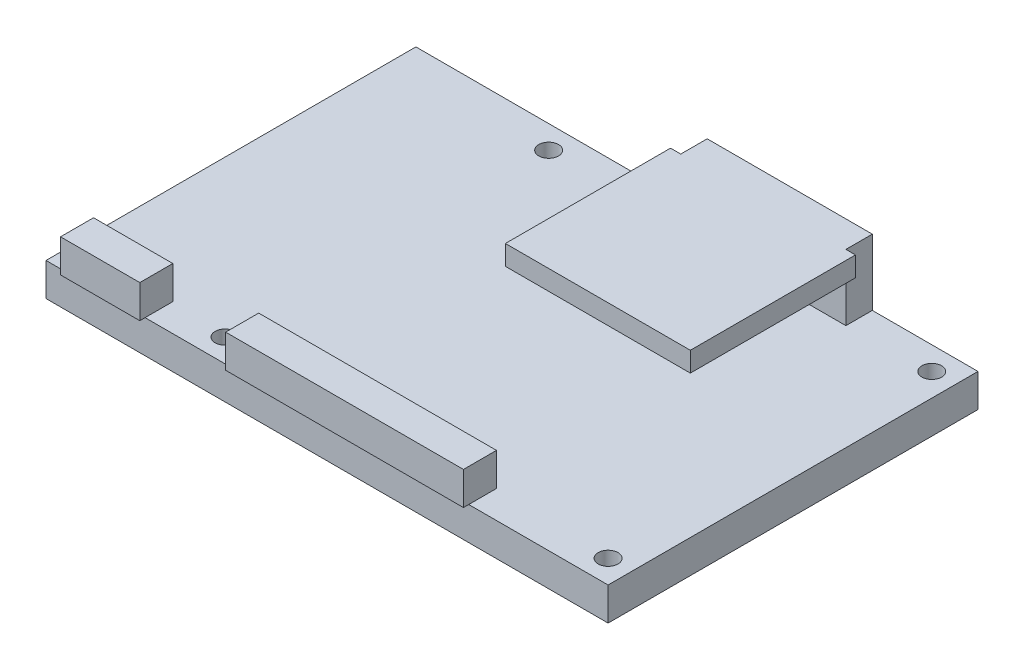
from build123d import *

# Parameters (mm, degrees)
SKETCH1_W           = 85.1
SKETCH1_H           = 56
SKETCH1_R           = 1.5
BOSS_EXTRUDE1_DEPTH = 5
SKETCH3_W           = 12
SKETCH3_H           = 5
BOSS_EXTRUDE2_DEPTH = 5
SKETCH4_W           = 25
SKETCH4_H           = 4
BOSS_EXTRUDE3_DEPTH = 10
SKETCH5_W           = 28
SKETCH5_H           = 3
BOSS_EXTRUDE4_DEPTH = 25


with BuildPart() as part:
    # Sketch1 → Boss-Extrude1 (new body)
    with BuildSketch(Plane(origin=(0, 0, 0), x_dir=(1, 0, 0), z_dir=(0, 1, 0))):
        Rectangle(SKETCH1_W, SKETCH1_H)
        with Locations(Location((-18.95, -24.5, 0), (0, 0, 270))):
            Circle(SKETCH1_R, mode=Mode.SUBTRACT)
        with Locations(Location((39.05, -24.5, 0), (0, 0, 270))):
            Circle(SKETCH1_R, mode=Mode.SUBTRACT)
        with Locations(Location((39.05, 24.5, 0), (0, 0, 270))):
            Circle(SKETCH1_R, mode=Mode.SUBTRACT)
        with Locations(Location((-18.95, 24.5, 0), (0, 0, 270))):
            Circle(SKETCH1_R, mode=Mode.SUBTRACT)
    extrude(amount=BOSS_EXTRUDE1_DEPTH)

    # Sketch3 → Boss-Extrude2 (add)
    with BuildSketch(Plane(origin=(0, 5, 0), x_dir=(1, 0, 0), z_dir=(0, 1, 0))):
        with Locations((-33.55, -26.3)):
            Rectangle(SKETCH3_W, SKETCH3_H)
        with Locations((-8.55, -26.3)):
            Rectangle(SKETCH3_W, SKETCH3_H)
        with Locations((3.45, -26.3)):
            Rectangle(SKETCH3_W, SKETCH3_H)
        with Locations((15.45, -26.3)):
            Rectangle(SKETCH3_W, SKETCH3_H)
    extrude(amount=BOSS_EXTRUDE2_DEPTH)

    # Sketch4 → Boss-Extrude3 (add)
    with BuildSketch(Plane(origin=(0, 5, 0), x_dir=(1, 0, 0), z_dir=(0, 1, 0))):
        with Locations((14.05, 26)):
            Rectangle(SKETCH4_W, SKETCH4_H)
    extrude(amount=BOSS_EXTRUDE3_DEPTH)

    # Sketch5 → Boss-Extrude4 (add)
    with BuildSketch(Plane.XY.offset(-24)):
        with Locations((14, 13.5)):
            Rectangle(SKETCH5_W, SKETCH5_H)
    extrude(amount=BOSS_EXTRUDE4_DEPTH)


solid = part.part
